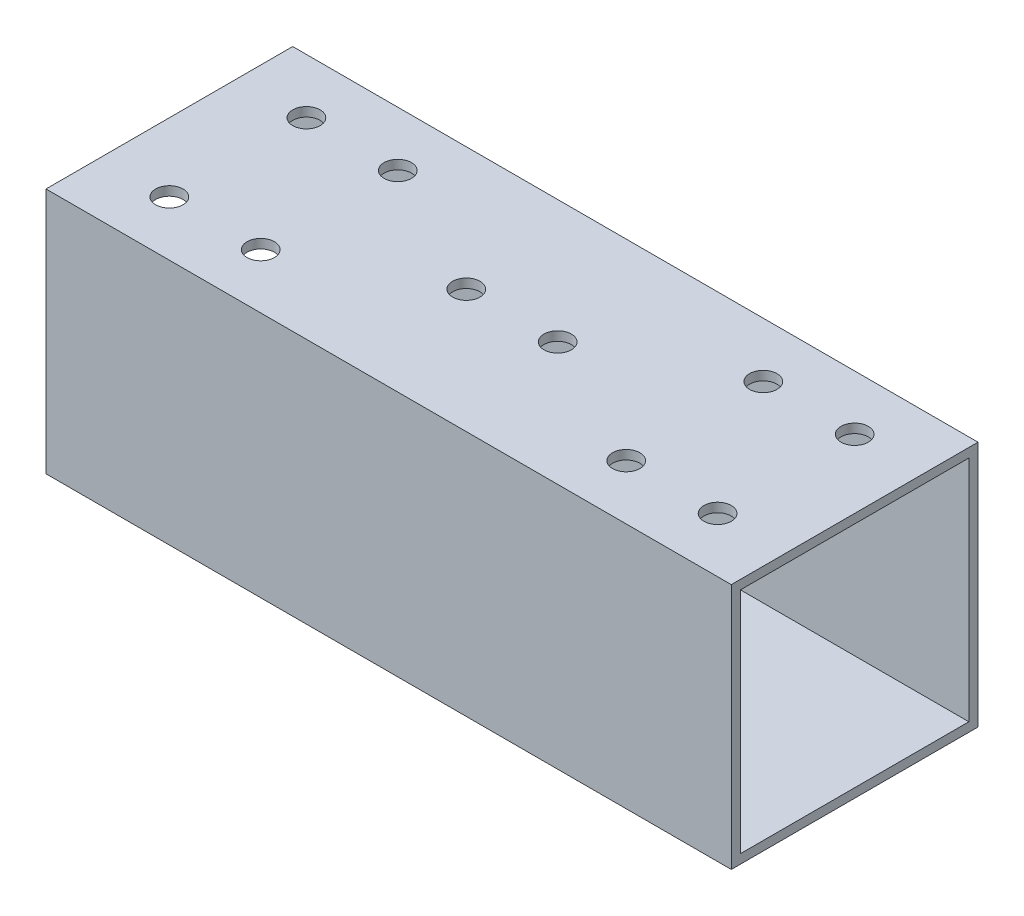
from build123d import *

# Parameters (mm, degrees)
SKETCH1_W           = 54
SKETCH1_H           = 54
SKETCH1_W_2         = 50
SKETCH1_H_2         = 50
BOSS_EXTRUDE1_DEPTH = 75
SKETCH2_R           = 3
CUT_EXTRUDE1_DEPTH  = 25
SKETCH3_R           = 3
CUT_EXTRUDE2_DEPTH  = 25


with BuildPart() as part:
    # Sketch1 → Boss-Extrude1 (new, symmetric)
    with BuildSketch(Plane(origin=(0, 0, 0), x_dir=(0, 0, -1), z_dir=(1, 0, 0))):
        Rectangle(SKETCH1_W, SKETCH1_H)
        Rectangle(SKETCH1_W_2, SKETCH1_H_2, mode=Mode.SUBTRACT)
    extrude(amount=BOSS_EXTRUDE1_DEPTH, both=True)

    # Sketch2 → Cut-Extrude1 (cut)
    with BuildSketch(Plane(origin=(0, 27, 0), x_dir=(1, 0, 0), z_dir=(0, 1, 0))):
        with Locations(Location((-60, 15, 0), (0, 0, 270))):
            Circle(SKETCH2_R)
        with Locations(Location((-60, -15, 0), (0, 0, 270))):
            Circle(SKETCH2_R)
        with Locations(Location((60, 15, 0), (0, 0, 270))):
            Circle(SKETCH2_R)
        with Locations(Location((60, -15, 0), (0, 0, 270))):
            Circle(SKETCH2_R)
        with Locations(Location((-40, -15, 0), (0, 0, 270))):
            Circle(SKETCH2_R)
        with Locations(Location((-40, 15, 0), (0, 0, 270))):
            Circle(SKETCH2_R)
        with Locations(Location((40, -15, 0), (0, 0, 90))):
            Circle(SKETCH2_R)
        with Locations(Location((40, 15, 0), (0, 0, 90))):
            Circle(SKETCH2_R)
    extrude(amount=-CUT_EXTRUDE1_DEPTH, mode=Mode.SUBTRACT)

    # Sketch3 → Cut-Extrude2 (cut)
    with BuildSketch(Plane(origin=(0, 27, 0), x_dir=(1, 0, 0), z_dir=(0, 1, 0))):
        with Locations(Location((-10, 0, 0), (0, 0, 270))):
            Circle(SKETCH3_R)
        with Locations(Location((10, 0, 0), (0, 0, 270))):
            Circle(SKETCH3_R)
    extrude(amount=-CUT_EXTRUDE2_DEPTH, mode=Mode.SUBTRACT)


solid = part.part
